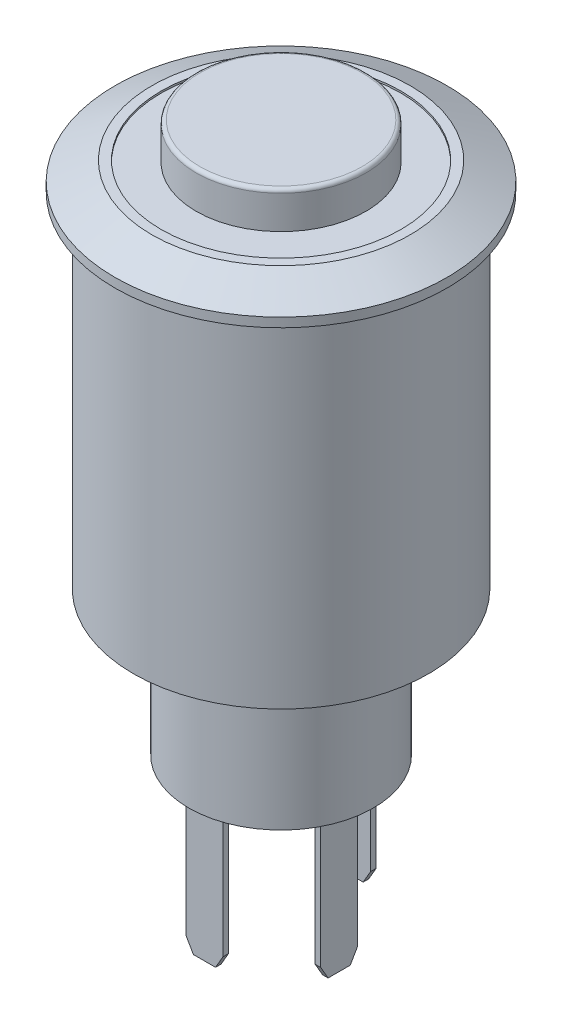
from build123d import *
from OCP.BRepFilletAPI import BRepFilletAPI_MakeChamfer

# Parameters (mm, degrees)
FILLET1_R           = 0.2
CUT_EXTRUDE1_START  = -0.1
SKETCH2_R           = 6.5
SKETCH2_R_2         = 4.6
CUT_EXTRUDE1_DEPTH  = 0.1
SKETCH3_W           = 2
SKETCH3_H           = 0.3
SKETCH3_W_2         = 0.3
SKETCH3_H_2         = 2
EXTRUDE_THIN1_DEPTH = 7.6
CHAMFER1_SIZE       = 0.4
CHAMFER1_SIZE2      = 0.692820323


with BuildPart() as part:
    # Sketch1 → Revolve1 (revolve)
    with BuildSketch(Plane(origin=(0, 0, 0), x_dir=(0, 0, -1), z_dir=(1, 0, 0))):
        Polygon((0, 3.4), (-4.6, 3.4), (-4.6, 1.5), (-7, 1.5), (-9, 0.5), (-9, 0), (-8, 0), (-8, -18.6), (-5, -18.6), (-5, -26.4), (0, -26.4), align=None)
    revolve(axis=Axis((0, 14.375, 0), (0, -1, 0)))

    # Fillet1
    fillet1_edges = [part.edges().sort_by_distance(p)[0] for p in [
        (0, 3.4, -4.6),
    ]]
    fillet(fillet1_edges, radius=FILLET1_R)

    # Sketch2 → Cut-Extrude1 (cut)
    with BuildSketch(Plane(origin=(0, 1.5, 0), x_dir=(1, 0, 0), z_dir=(0, 1, 0)).offset(CUT_EXTRUDE1_START)):
        with Locations(Location((0, 0, 0), (0, 0, 270))):
            Circle(SKETCH2_R)
        with Locations(Location((0, 0, 0), (0, 0, 270))):
            Circle(SKETCH2_R_2, mode=Mode.SUBTRACT)
    extrude(amount=CUT_EXTRUDE1_DEPTH, mode=Mode.SUBTRACT)

    # Sketch3 → Extrude-Thin1 (add)
    with BuildSketch(Plane.XZ.offset(26.4)):
        with Locations((0, 4)):
            Rectangle(SKETCH3_W, SKETCH3_H)
        with Locations((0, -4)):
            Rectangle(SKETCH3_W, SKETCH3_H)
        with Locations((-4, 0)):
            Rectangle(SKETCH3_W_2, SKETCH3_H_2)
        with Locations((4, 1)):
            Rectangle(SKETCH3_W_2, SKETCH3_H_2)
    extrude(amount=EXTRUDE_THIN1_DEPTH)

    # Chamfer1: one chamfer whose edges measure the first distance from different faces: ONE call of the kernel's chamfer builder (chamfer() names one face for all edges)
    chamfer1_edges_1 = [part.edges().sort_by_distance(p)[0] for p in [
        (1, -34, 4),
        (-1, -34, 4),
    ]]
    chamfer1_side_1 = [part.faces().sort_by_distance(p)[0] for p in [
        (0, -34, 4),
    ]]
    chamfer1_edges_2 = [part.edges().sort_by_distance(p)[0] for p in [
        (1, -34, -4),
        (-1, -34, -4),
    ]]
    chamfer1_side_2 = [part.faces().sort_by_distance(p)[0] for p in [
        (0, -34, -4),
    ]]
    chamfer1_edges_3 = [part.edges().sort_by_distance(p)[0] for p in [
        (-4, -34, -1),
        (-4, -34, 1),
    ]]
    chamfer1_side_3 = [part.faces().sort_by_distance(p)[0] for p in [
        (-4, -34, 0),
    ]]
    chamfer1_edges_4 = [part.edges().sort_by_distance(p)[0] for p in [
        (4, -34, 2),
        (4, -34, 0),
    ]]
    chamfer1_side_4 = [part.faces().sort_by_distance(p)[0] for p in [
        (4, -34, 1),
    ]]
    chamfer1 = BRepFilletAPI_MakeChamfer(part.part.solid().wrapped)
    for e in chamfer1_edges_1:
        chamfer1.Add(CHAMFER1_SIZE, CHAMFER1_SIZE2, e.wrapped, chamfer1_side_1[0].wrapped)  # the first distance lies on this face
    for e in chamfer1_edges_2:
        chamfer1.Add(CHAMFER1_SIZE, CHAMFER1_SIZE2, e.wrapped, chamfer1_side_2[0].wrapped)  # the first distance lies on this face
    for e in chamfer1_edges_3:
        chamfer1.Add(CHAMFER1_SIZE, CHAMFER1_SIZE2, e.wrapped, chamfer1_side_3[0].wrapped)  # the first distance lies on this face
    for e in chamfer1_edges_4:
        chamfer1.Add(CHAMFER1_SIZE, CHAMFER1_SIZE2, e.wrapped, chamfer1_side_4[0].wrapped)  # the first distance lies on this face
    add(Compound.cast(chamfer1.Shape()), mode=Mode.REPLACE)


solid = part.part
